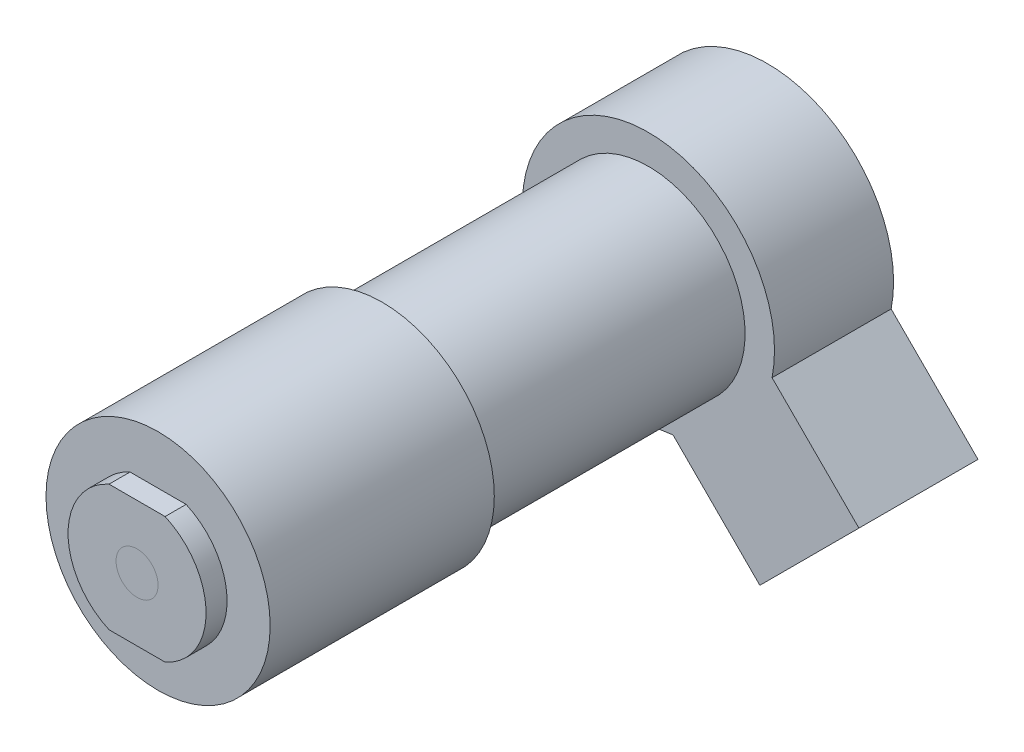
from build123d import *

# Parameters (mm, degrees)
BOSS_EXTRUDE1_DEPTH = 3
SKETCH2_R           = 16
BOSS_EXTRUDE2_DEPTH = 32
SKETCH3_R           = 13.8
BOSS_EXTRUDE3_DEPTH = 38
SKETCH4_R           = 18
SKETCH4_R_2         = 13.8
BOSS_EXTRUDE4_DEPTH = 17


with BuildPart() as part:
    # Sketch1 → Boss-Extrude1 (new body)
    with BuildSketch(Plane.XY):
        with BuildLine():
            Line((-4.002811512, 9), (4.002811512, 9))
            ThreePointArc((4.002811512, 9), (9.85, 0), (4.002811512, -9))
            Line((4.002811512, -9), (-4.002811512, -9))
            ThreePointArc((-4.002811512, -9), (-9.85, 0), (-4.002811512, 9))
        make_face()
    extrude(amount=BOSS_EXTRUDE1_DEPTH)

    # Sketch2 → Boss-Extrude2 (add)
    with BuildSketch(Plane(origin=(0, 0, 0), x_dir=(-1, 0, 0), z_dir=(0, 0, -1))):
        Circle(SKETCH2_R)
    extrude(amount=BOSS_EXTRUDE2_DEPTH)

    # Sketch3 → Boss-Extrude3 (add)
    with BuildSketch(Plane(origin=(0, 0, -32), x_dir=(-1, 0, 0), z_dir=(0, 0, -1))):
        Circle(SKETCH3_R)
    extrude(amount=BOSS_EXTRUDE3_DEPTH)

    # Sketch4 → Boss-Extrude4 (add)
    # profile 1 of 3: a face of its own
    with BuildSketch(Plane(origin=(0, 0, -70), x_dir=(-1, 0, 0), z_dir=(0, 0, -1))):
        Circle(SKETCH4_R)
        Circle(SKETCH4_R_2, mode=Mode.SUBTRACT)
    # profile 2 of 3: a face of its own
    with BuildSketch(Plane(origin=(0, 0, -70), x_dir=(-1, 0, 0), z_dir=(0, 0, -1))):
        Circle(SKETCH4_R_2)
    # profile 3 of 3: a face of its own
    with BuildSketch(Plane(origin=(0, 0, -70), x_dir=(-1, 0, 0), z_dir=(0, 0, -1))):
        with BuildLine():
            Line((-17.654073056, -3.511937432), (-30.0520382, -15.909902577))
            Line((-30.0520382, -15.909902577), (-15.909902577, -30.0520382))
            Line((-15.909902577, -30.0520382), (-3.511937432, -17.654073056))
            ThreePointArc((-3.511937432, -17.654073056), (-12.727922061, -12.727922061), (-17.654073056, -3.511937432))
        make_face()
    extrude(amount=BOSS_EXTRUDE4_DEPTH)


solid = part.part
